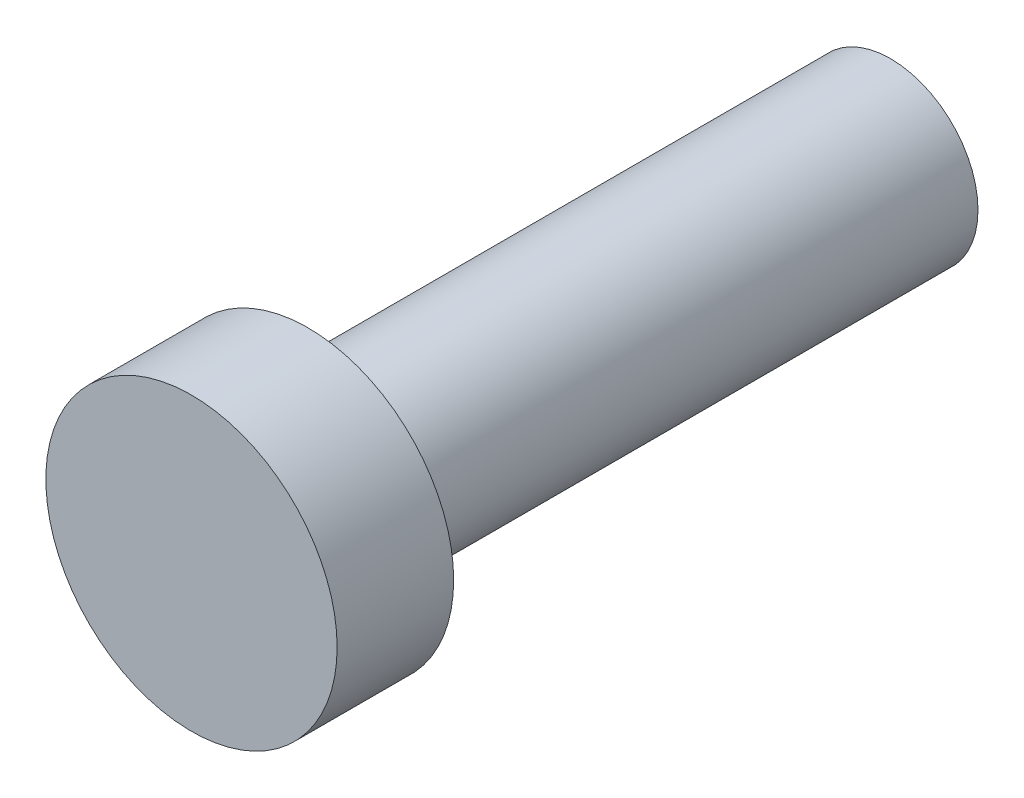
from build123d import *

# Parameters (mm, degrees)
ESQUISSE1_R        = 1.5
BOSS_EXTRU_1_DEPTH = 10
ESQUISSE2_R        = 2.5
BOSS_EXTRU_2_DEPTH = 2


with BuildPart() as part:
    # Esquisse1 → Boss.-Extru.1 (new body)
    with BuildSketch(Plane.XY):
        Circle(ESQUISSE1_R)
    extrude(amount=-BOSS_EXTRU_1_DEPTH)

    # Esquisse2 → Boss.-Extru.2 (add)
    with BuildSketch(Plane.XY):
        Circle(ESQUISSE2_R)
    extrude(amount=BOSS_EXTRU_2_DEPTH)


solid = part.part
